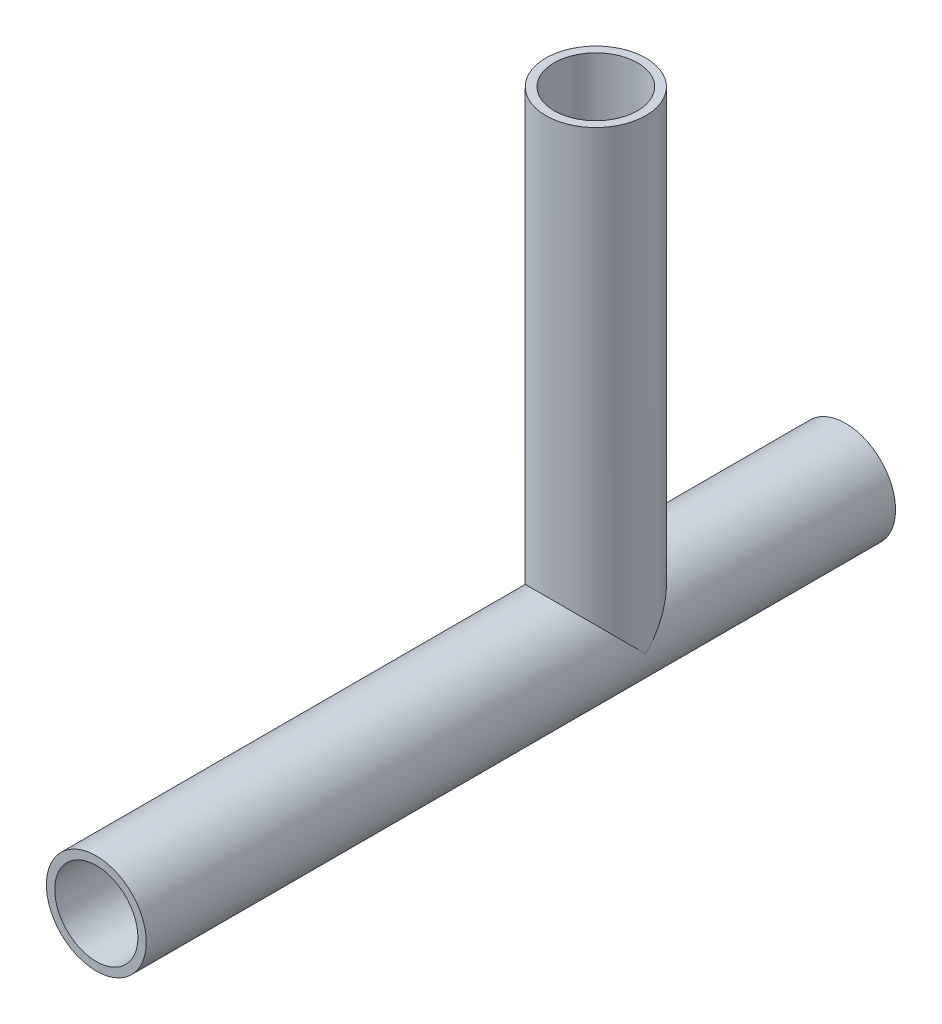
from build123d import *

# Parameters (mm, degrees)
BOSS_EXTRU_1_DEPTH      = 30
BOSS_EXTRU_1_DEPTH_BACK = 15
ESQUISSE1_R             = 3
ESQUISSE1_R_2           = 2.5
ESQUISSE2_R             = 3
ESQUISSE2_R_2           = 2.5
BOSS_EXTRU_2_DEPTH      = 28


with BuildPart() as part:
    # Esquisse1 → Boss.-Extru.1 (new, two sides: drawn at the far end of the back side and taken through both)
    with BuildSketch(Plane.XY.offset(-BOSS_EXTRU_1_DEPTH_BACK)):
        Circle(ESQUISSE1_R)
        Circle(ESQUISSE1_R_2, mode=Mode.SUBTRACT)
    extrude(amount=BOSS_EXTRU_1_DEPTH + BOSS_EXTRU_1_DEPTH_BACK)

    # Esquisse2 → Boss.-Extru.2 (add)
    with BuildSketch(Plane(origin=(0, 0, 0), x_dir=(1, 0, 0), z_dir=(0, 1, 0))):
        Circle(ESQUISSE2_R)
        with Locations(Location((0, 0, 0), (0, 0, 90))):
            Circle(ESQUISSE2_R_2, mode=Mode.SUBTRACT)
    extrude(amount=BOSS_EXTRU_2_DEPTH)


solid = part.part
